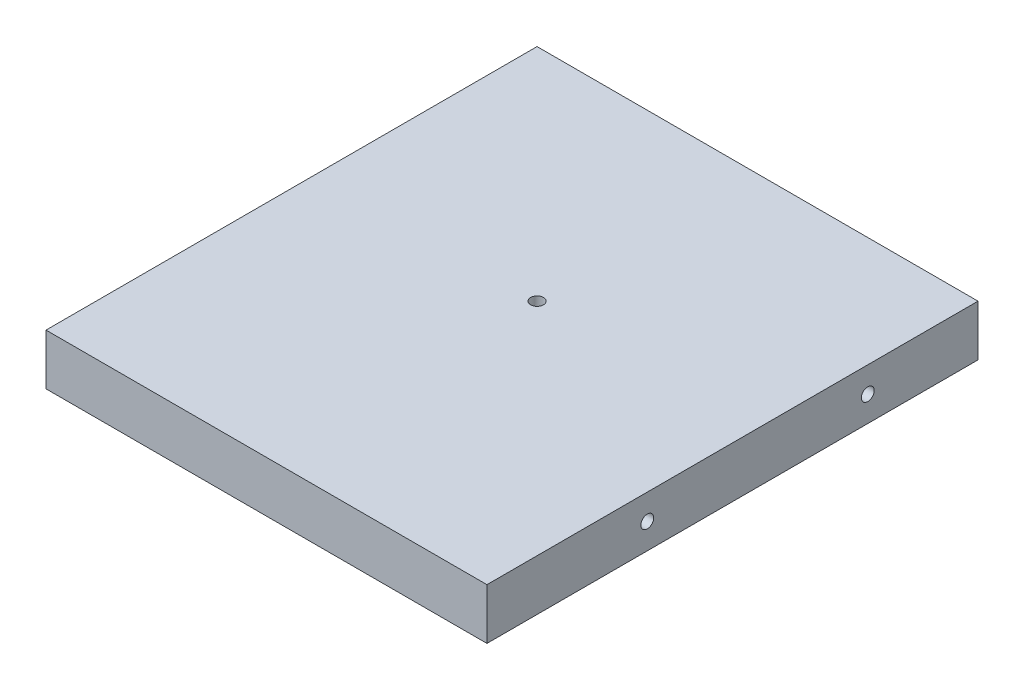
from build123d import *

# Parameters (mm, degrees)
SKETCH4_W           = 220
SKETCH4_H           = 220
BOSS_EXTRUDE2_DEPTH = 25.4
SKETCH5_R           = 3.2
CUT_EXTRUDE1_DEPTH  = 25.4
SKETCH7_R           = 3.2
CUT_EXTRUDE2_DEPTH  = 30
CUT_EXTRUDE4_START  = -30
SKETCH6_R           = 3.2
CUT_EXTRUDE4_DEPTH  = 30
SKETCH13_W          = 220
SKETCH13_H          = 25.4
BOSS_EXTRUDE3_DEPTH = 25


with BuildPart() as part:
    # Sketch4 → Boss-Extrude2 (new body)
    with BuildSketch(Plane(origin=(0, 0, 0), x_dir=(1, 0, 0), z_dir=(0, 1, 0))):
        with Locations((171.772904357, 21.481047821)):
            Rectangle(SKETCH4_W, SKETCH4_H)
    extrude(amount=BOSS_EXTRUDE2_DEPTH)

    # Sketch5 → Cut-Extrude1 (cut)
    with BuildSketch(Plane(origin=(0, 25.4, 0), x_dir=(1, 0, 0), z_dir=(0, 1, 0))):
        with Locations(Location((171.772904357, 21.481047821, 0), (0, 0, 270))):
            Circle(SKETCH5_R)
    extrude(amount=-CUT_EXTRUDE1_DEPTH, mode=Mode.SUBTRACT)

    # Sketch7 → Cut-Extrude2 (cut)
    with BuildSketch(Plane.ZY.offset(-61.772904357)):
        with Locations((-76.481047821, 12.7)):
            Circle(SKETCH7_R)
        with Locations((33.518952179, 12.7)):
            Circle(SKETCH7_R)
    extrude(amount=-CUT_EXTRUDE2_DEPTH, mode=Mode.SUBTRACT)

    # Sketch6 → Cut-Extrude4 (cut)
    with BuildSketch(Plane(origin=(281.772904357, 0, 0), x_dir=(0, 0, -1), z_dir=(1, 0, 0)).offset(CUT_EXTRUDE4_START)):
        with Locations(Location((-33.518952179, 12.7, 0), (0, 0, 180))):
            Circle(SKETCH6_R)
        with Locations(Location((76.481047821, 12.7, 0), (0, 0, 180))):
            Circle(SKETCH6_R)
    extrude(amount=CUT_EXTRUDE4_DEPTH, mode=Mode.SUBTRACT)

    # Sketch13 → Boss-Extrude3 (add)
    with BuildSketch(Plane.XY.offset(88.518952179)):
        with Locations((171.772904357, 12.7)):
            Rectangle(SKETCH13_W, SKETCH13_H)
    extrude(amount=BOSS_EXTRUDE3_DEPTH)


solid = part.part
